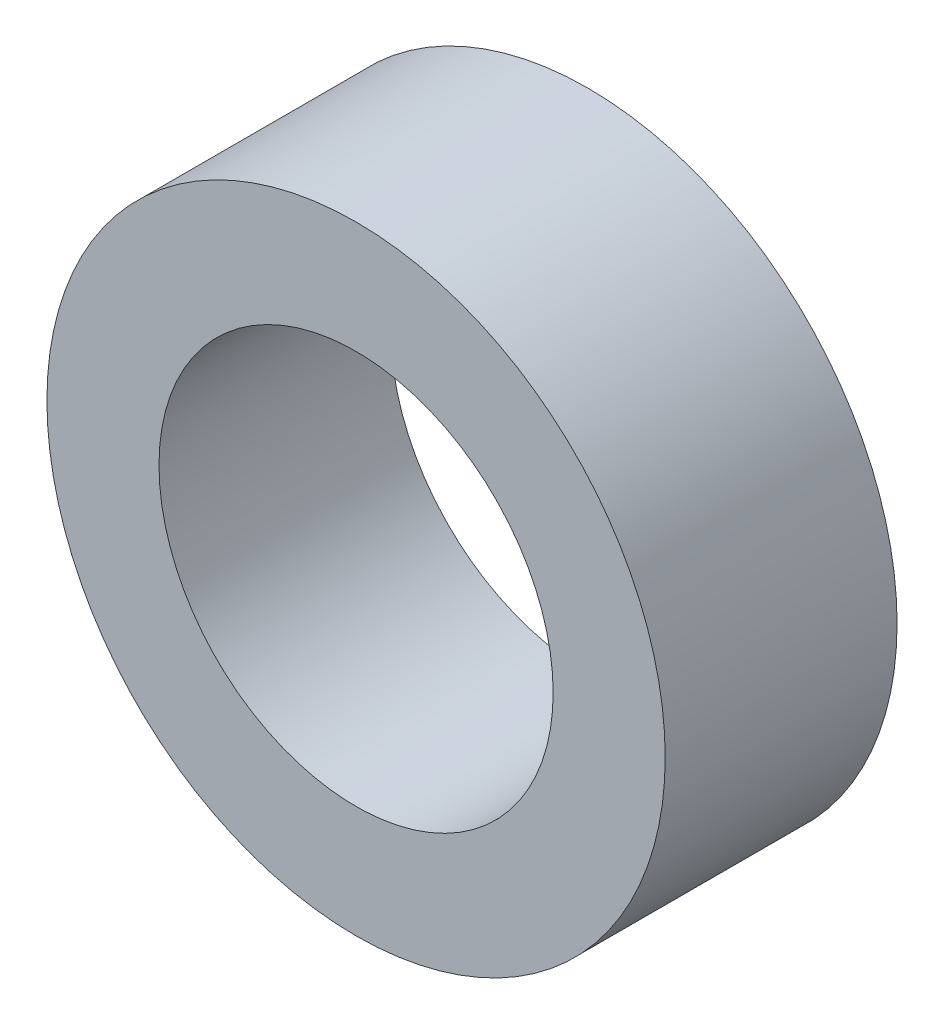
from build123d import *

# Parameters (mm, degrees)
SZKIC1_R                    = 8
SZKIC1_R_2                  = 5.1
DODANIE_WYCI_GNI_CIE1_DEPTH = 6


with BuildPart() as part:
    # Szkic1 → Dodanie-wyciągnięcie1 (new body)
    with BuildSketch(Plane.XY):
        Circle(SZKIC1_R)
        Circle(SZKIC1_R_2, mode=Mode.SUBTRACT)
    extrude(amount=DODANIE_WYCI_GNI_CIE1_DEPTH)


solid = part.part
